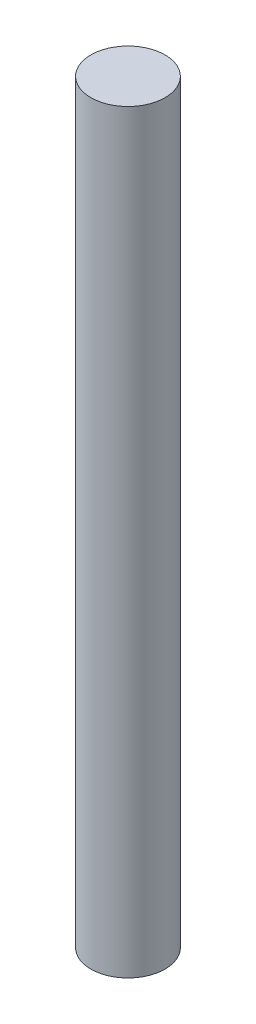
from build123d import *

# Parameters (mm, degrees)
SKETCH1_R           = 28
SKETCH1_R_2         = 26
BOSS_EXTRUDE1_DEPTH = 570
BOSS_EXTRUDE2_START = -2
SKETCH2_R           = 26
BOSS_EXTRUDE2_DEPTH = 2


with BuildPart() as part:
    # Sketch1 → Boss-Extrude1 (new body)
    with BuildSketch(Plane(origin=(0, 0, 0), x_dir=(1, 0, 0), z_dir=(0, 1, 0))):
        with Locations(Location((0, 0, 0), (0, 0, 270))):
            Circle(SKETCH1_R)
        with Locations(Location((0, 0, 0), (0, 0, 270))):
            Circle(SKETCH1_R_2, mode=Mode.SUBTRACT)
    extrude(amount=BOSS_EXTRUDE1_DEPTH)

    # Sketch2 → Boss-Extrude2 (add)
    with BuildSketch(Plane(origin=(0, 570, 0), x_dir=(1, 0, 0), z_dir=(0, 1, 0)).offset(BOSS_EXTRUDE2_START)):
        with Locations(Location((0, 0, 0), (0, 0, 270))):
            Circle(SKETCH2_R)
    extrude(amount=BOSS_EXTRUDE2_DEPTH)


solid = part.part
